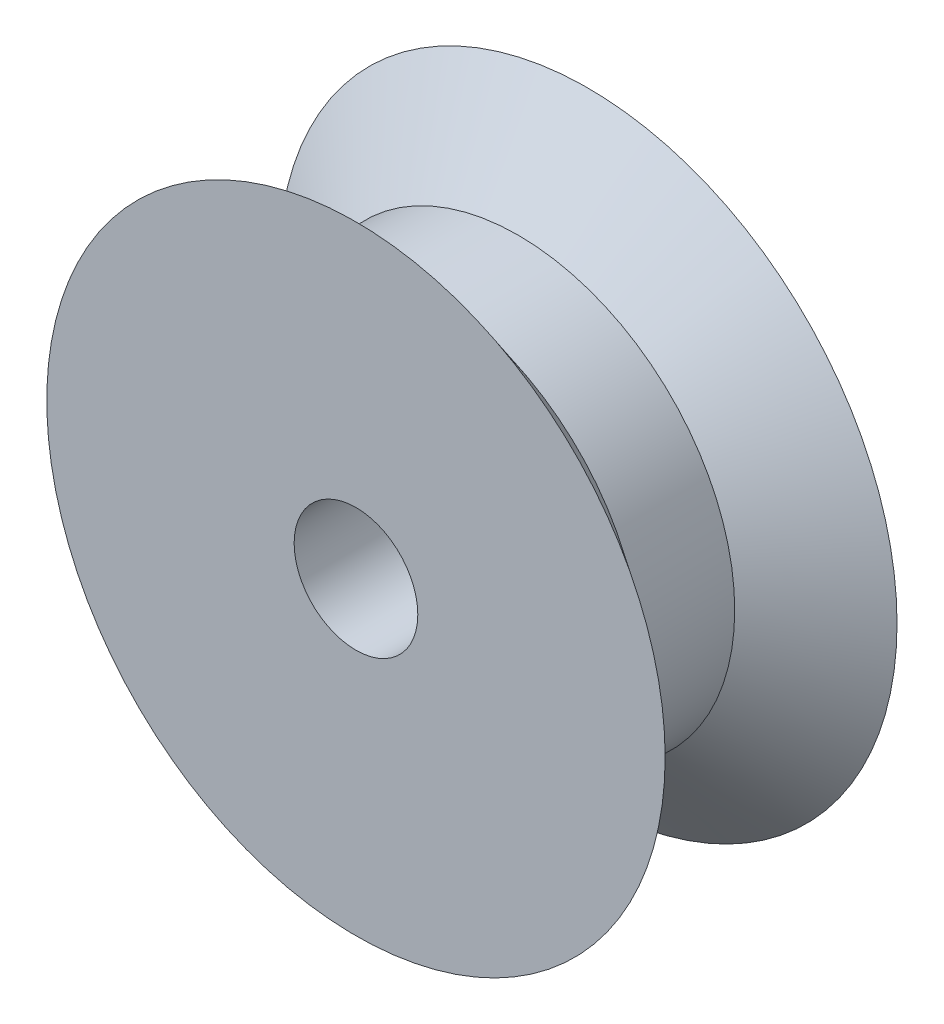
from build123d import *

# Parameters (mm, degrees)
SKETCH1_R               = 25.4
SKETCH1_R_2             = 5.08
BOSS_EXTRUDE1_DEPTH     = 19.05
BOSS_EXTRUDE2_START     = 6.35
SKETCH4_R               = 12.7
SKETCH4_R_2             = 5.08
BOSS_EXTRUDE2_DEPTH     = 6.35
CUT_EXTRUDE1_REACH      = 51.595
CUT_EXTRUDE1_END_RADIUS = 5.08
SKETCH5_R               = 1.27


with BuildPart() as part:
    # Sketch1 → Boss-Extrude1 (new body)
    with BuildSketch(Plane.XY):
        with Locations(Location((0, 0, 0), (0, 0, 180))):
            Circle(SKETCH1_R)
        with Locations(Location((0, 0, 0), (0, 0, 180))):
            Circle(SKETCH1_R_2, mode=Mode.SUBTRACT)
    extrude(amount=BOSS_EXTRUDE1_DEPTH)

    # Sketch3 → Cut-Revolve1 (revolve, cut)
    with BuildSketch(Plane(origin=(0, 0, 0), x_dir=(0, 0, -1), z_dir=(1, 0, 0)), mode=Mode.PRIVATE) as cut_revolve1_sk:
        Polygon((0, 25.4), (0, 34.911662418), (-19.05, 34.911662418), (-19.05, 25.4), (-13.335, 17.78), (-5.715, 17.78), align=None)
    revolve(cut_revolve1_sk.sketch.rotate(Axis((0, 0, 21.061205324), (0, 0, -1)), 90), axis=Axis((0, 0, 21.061205324), (0, 0, -1)), mode=Mode.SUBTRACT)

    # Sketch4 → Boss-Extrude2 (add)
    with BuildSketch(Plane(origin=(0, 0, 0), x_dir=(-1, 0, 0), z_dir=(0, 0, -1)).offset(BOSS_EXTRUDE2_START)):
        with Locations(Location((0, 0, 0), (0, 0, 180))):
            Circle(SKETCH4_R)
        Circle(SKETCH4_R_2, mode=Mode.SUBTRACT)
    extrude(amount=-BOSS_EXTRUDE2_DEPTH)

    # Cut-Extrude1: up to this cylinder (the profile starts outside it)
    cut_extrude1_end = Plane(origin=(0, 0, -3.175), z_dir=(0, 0, -1)) * Cylinder(CUT_EXTRUDE1_END_RADIUS, 114.35, mode=Mode.PRIVATE)
    # Sketch5 → Cut-Extrude1 (cut, up to the surface)
    with BuildSketch(Plane(origin=(12.7, 0, 0), x_dir=(0, 0, -1), z_dir=(1, 0, 0)), mode=Mode.PRIVATE) as cut_extrude1_sk1:
        with Locations((3.175, 0)):
            Circle(SKETCH5_R)
    cut_extrude1_tool1 = extrude(cut_extrude1_sk1.sketch, amount=-CUT_EXTRUDE1_REACH, mode=Mode.PRIVATE) - cut_extrude1_end
    add(cut_extrude1_tool1.solids().sort_by_distance((12.7, 0, -3.175))[0], mode=Mode.SUBTRACT)


solid = part.part
